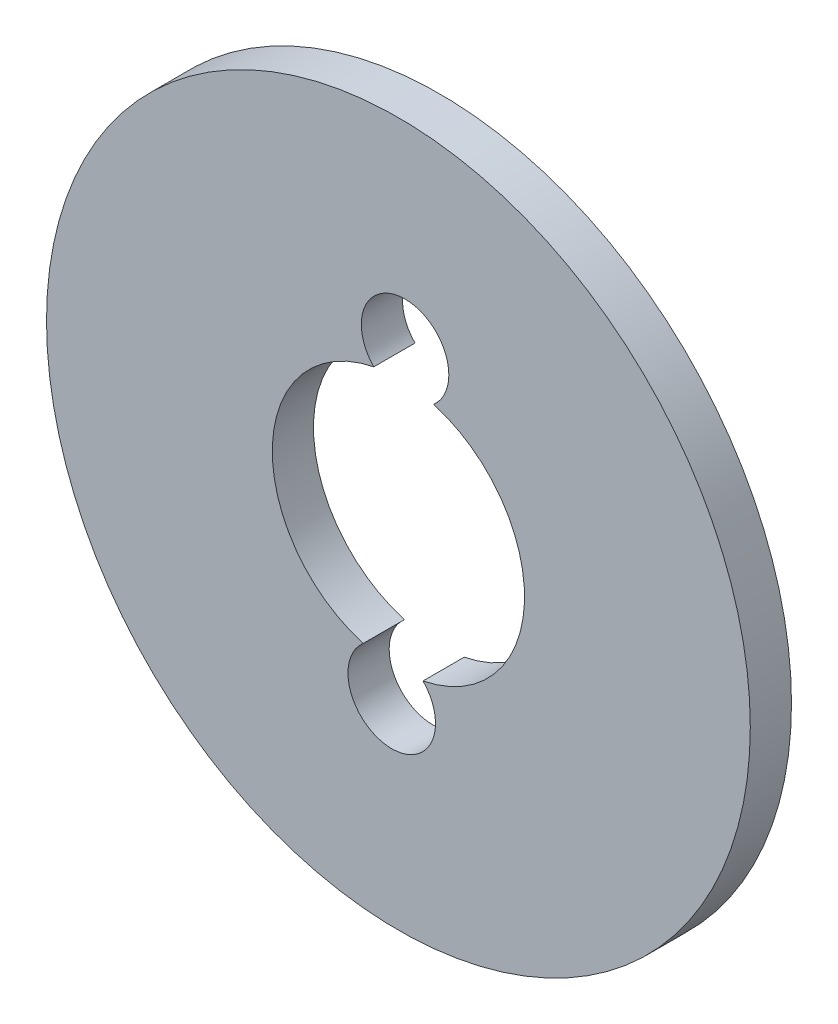
from build123d import *

# Parameters (mm, degrees)
ESQUISSE1_R             = 6.835577951
ESQUISSE1_R_2           = 2.45
BOSS_EXTRU_1_DEPTH      = 0.8
ESQUISSE3_R             = 0.85
ENL_V_MAT_EXTRU_1_DEPTH = 10.700012982


with BuildPart() as part:
    # Esquisse1 → Boss.-Extru.1 (new body)
    with BuildSketch(Plane.XY):
        Circle(ESQUISSE1_R)
        Circle(ESQUISSE1_R_2, mode=Mode.SUBTRACT)
    extrude(amount=-BOSS_EXTRU_1_DEPTH)

    # Esquisse3 → Enlèv. mat.-Extru.1 (cut, through all)
    with BuildSketch(Plane(origin=(0, 0, -0.8), x_dir=(-1, 0, 0), z_dir=(0, 0, -1))):
        with Locations((-0.129516777, 2.99720293)):
            Circle(ESQUISSE3_R)
        with Locations((0.129516777, -2.99720293)):
            Circle(ESQUISSE3_R)
    extrude(amount=-ENL_V_MAT_EXTRU_1_DEPTH, mode=Mode.SUBTRACT)


solid = part.part
